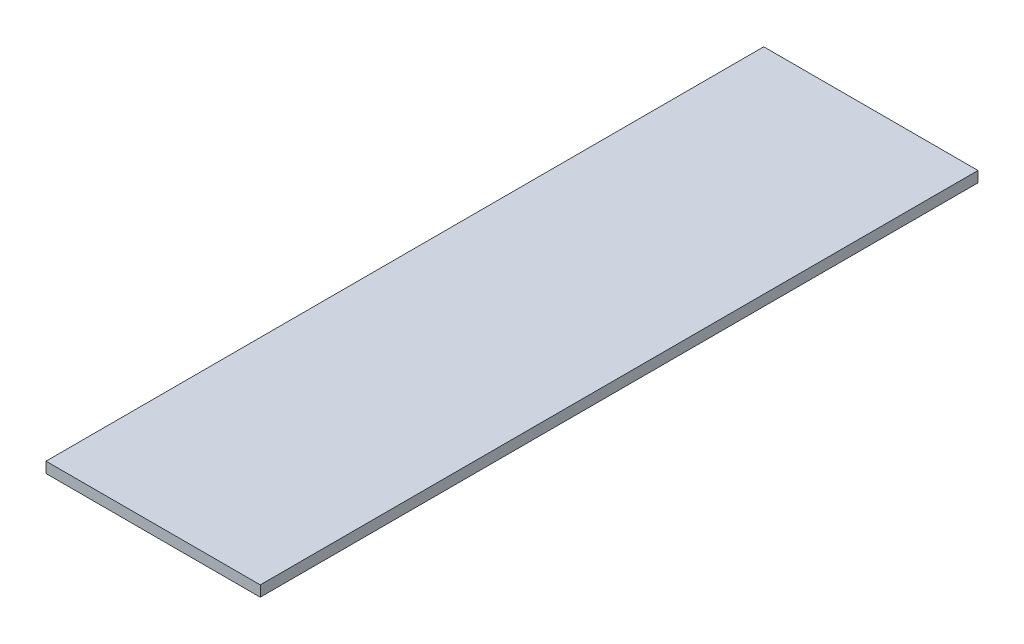
from build123d import *

# Parameters (mm, degrees)
SKETCH1_W           = 63.5
SKETCH1_H           = 212.725
BOSS_EXTRUDE1_DEPTH = 3.175


with BuildPart() as part:
    # Sketch1 → Boss-Extrude1 (new body)
    with BuildSketch(Plane(origin=(0, 0, 0), x_dir=(1, 0, 0), z_dir=(0, 1, 0))):
        with Locations((31.75, 106.3625)):
            Rectangle(SKETCH1_W, SKETCH1_H)
    extrude(amount=BOSS_EXTRUDE1_DEPTH)


solid = part.part
